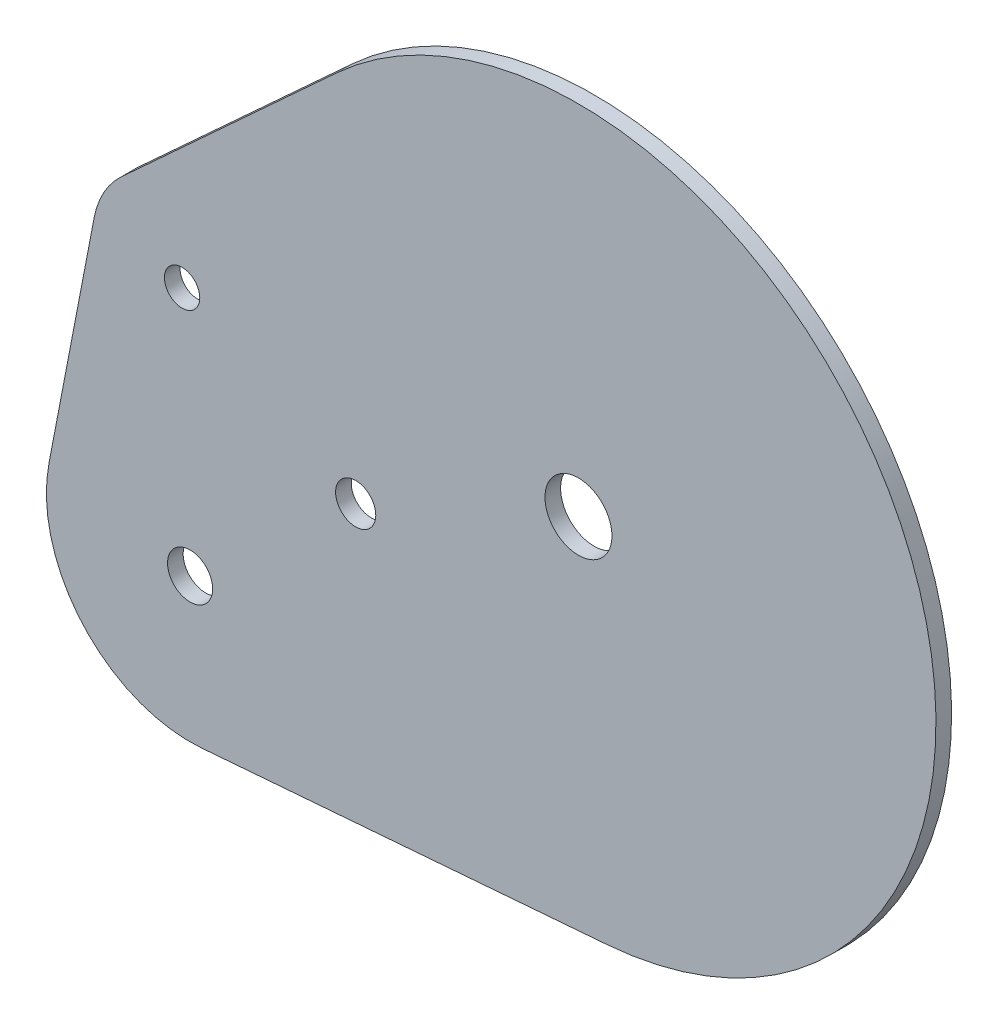
from build123d import *

# Parameters (mm, degrees)
SKETCH1_R           = 5.0254
SKETCH1_R_2         = 9.525
BOSS_EXTRUDE1_DEPTH = 4.445
SKETCH3_R           = 5.715
CUT_EXTRUDE4_DEPTH  = 238.309326519
SKETCH2_R           = 6.4135
BOSS_EXTRUDE2_DEPTH = 4.445
SKETCH6_W           = 13.50293176
SKETCH6_H           = 6.21934711
CUT_EXTRUDE6_DEPTH  = 2.54


with BuildPart() as part:
    # Sketch1 → Boss-Extrude1 (new body)
    with BuildSketch(Plane.XY):
        with BuildLine():
            Line((-17.211015945, 18.751241343), (43.963752379, 74.901119305))
            ThreePointArc((43.963752379, 74.901119305), (214.381413502, 0), (43.963752379, -74.901119305))
            Line((43.963752379, -74.901119305), (-17.211015945, -18.751241343))
            ThreePointArc((-17.211015945, -18.751241343), (-25.452467891, 0), (-17.211015945, 18.751241343))
        make_face()
        Circle(SKETCH1_R, mode=Mode.SUBTRACT)
        with Locations((112.7125, 0)):
            Circle(SKETCH1_R_2, mode=Mode.SUBTRACT)
    extrude(amount=BOSS_EXTRUDE1_DEPTH)

    # Sketch3 → Cut-Extrude4 (cut, through all)
    with BuildSketch(Plane.XY):
        with Locations((49.363448016, -28.5)):
            Circle(SKETCH3_R)
    extrude(amount=CUT_EXTRUDE4_DEPTH, mode=Mode.SUBTRACT)

    # Sketch2 → Boss-Extrude2 (add)
    with BuildSketch(Plane.XY):
        with BuildLine():
            Line((-24.995388267, 4.801946178), (-37.855905828, -62.140417979))
            ThreePointArc((-37.855905828, -62.140417979), (-28.163364792, -97.115789925), (5.538841954, -110.583650001))
            Line((5.538841954, -110.583650001), (120.834104773, -101.344005785))
            ThreePointArc((120.834104773, -101.344005785), (79.641074663, -96.139735796), (43.963752379, -74.901119305))
            Line((43.963752379, -74.901119305), (-17.211015945, -18.751241343))
            ThreePointArc((-17.211015945, -18.751241343), (-24.166780914, -7.987166081), (-24.995388267, 4.801946178))
        make_face()
        with Locations((2.274488984, -69.85)):
            Circle(SKETCH2_R, mode=Mode.SUBTRACT)
    extrude(amount=BOSS_EXTRUDE2_DEPTH)

    # Sketch6 → Cut-Extrude6 (cut)
    with BuildSketch(Plane(origin=(0, 0, 0), x_dir=(-1, 0, 0), z_dir=(0, 0, -1))):
        with Locations((-95.255563191, 46.998761557)):
            Rectangle(SKETCH6_W, SKETCH6_H)
    extrude(amount=-CUT_EXTRUDE6_DEPTH, mode=Mode.SUBTRACT)


solid = part.part
